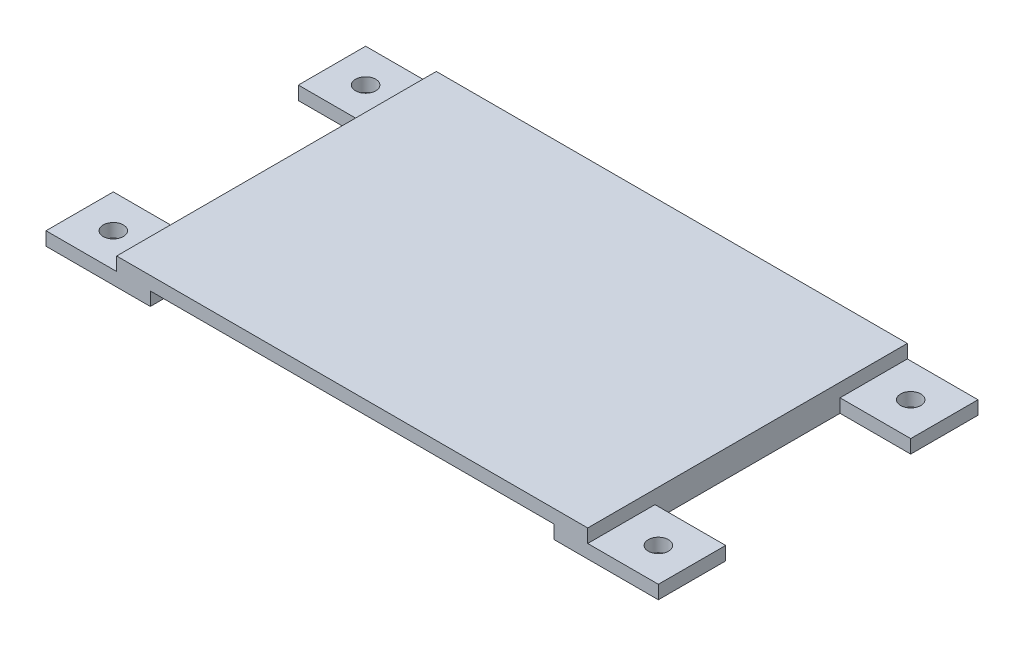
from build123d import *

# Parameters (mm, degrees)
SKETCH1_R           = 3
BOSS_EXTRUDE1_DEPTH = 8
SKETCH2_W           = 21
SKETCH2_H           = 20
CUT_EXTRUDE1_DEPTH  = 4
SKETCH3_W           = 120
SKETCH3_H           = 95
CUT_EXTRUDE2_DEPTH  = 4


with BuildPart() as part:
    # Sketch1 → Boss-Extrude1 (new body)
    with BuildSketch(Plane(origin=(0, 0, 0), x_dir=(1, 0, 0), z_dir=(0, 1, 0))):
        Polygon((0, 0), (21, 0), (161, 0), (182, 0), (182, -20), (161, -20), (161, -75), (182, -75), (182, -95), (0, -95), (0, -75), (21, -75), (21, -20), (0, -20), align=None)
        with Locations(Location((10, -10, 0), (0, 0, 270))):
            Circle(SKETCH1_R, mode=Mode.SUBTRACT)
        with Locations(Location((10, -85, 0), (0, 0, 270))):
            Circle(SKETCH1_R, mode=Mode.SUBTRACT)
        with Locations(Location((172, -10, 0), (0, 0, 90))):
            Circle(SKETCH1_R, mode=Mode.SUBTRACT)
        with Locations(Location((172, -85, 0), (0, 0, 90))):
            Circle(SKETCH1_R, mode=Mode.SUBTRACT)
    extrude(amount=BOSS_EXTRUDE1_DEPTH)

    # Sketch2 → Cut-Extrude1 (cut)
    with BuildSketch(Plane(origin=(0, 8, 0), x_dir=(1, 0, 0), z_dir=(0, 1, 0))):
        with Locations((10.5, -85)):
            Rectangle(SKETCH2_W, SKETCH2_H)
        with Locations((10.5, -10)):
            Rectangle(SKETCH2_W, SKETCH2_H)
        with Locations((171.5, -85)):
            Rectangle(SKETCH2_W, SKETCH2_H)
        with Locations((171.5, -10)):
            Rectangle(SKETCH2_W, SKETCH2_H)
    extrude(amount=-CUT_EXTRUDE1_DEPTH, mode=Mode.SUBTRACT)

    # Sketch3 → Cut-Extrude2 (cut)
    with BuildSketch(Plane.XZ):
        with Locations((91, 47.5)):
            Rectangle(SKETCH3_W, SKETCH3_H)
    extrude(amount=-CUT_EXTRUDE2_DEPTH, mode=Mode.SUBTRACT)


solid = part.part
